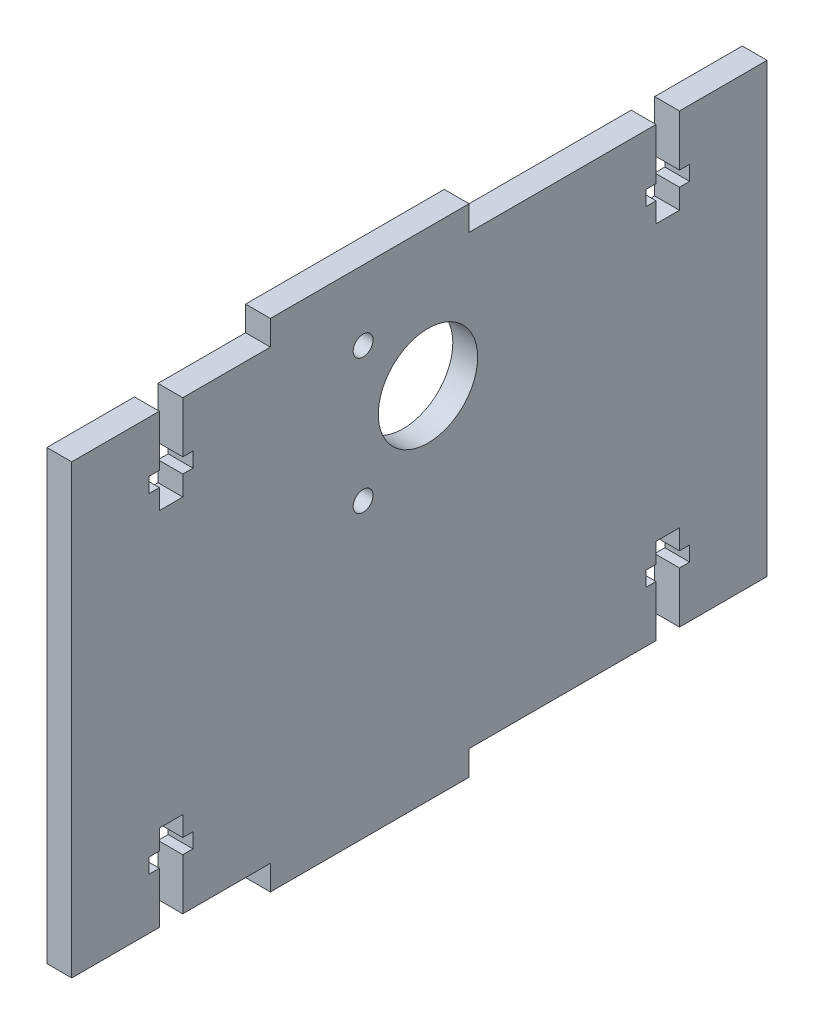
from build123d import *

# Parameters (mm, degrees)
SKETCH1_W           = 88.9
SKETCH1_H           = 63.5
BOSS_EXTRUDE1_DEPTH = 3.175
SKETCH2_W           = 38.1
SKETCH2_H           = 3.175
CUT_EXTRUDE1_DEPTH  = 55.716959208
CUT_EXTRUDE2_DEPTH  = 55.716959208
SKETCH4_R           = 6.35
SKETCH4_R_2         = 1.27
CUT_EXTRUDE3_DEPTH  = 55.716959208


with BuildPart() as part:
    # Sketch1 → Boss-Extrude1 (new body)
    with BuildSketch(Plane(origin=(0, 0, 0), x_dir=(0, 0, -1), z_dir=(1, 0, 0))):
        Rectangle(SKETCH1_W, SKETCH1_H)
    extrude(amount=BOSS_EXTRUDE1_DEPTH)

    # Sketch2 → Cut-Extrude1 (cut, through all)
    with BuildSketch(Plane(origin=(3.175, 0, 0), x_dir=(0, 0, -1), z_dir=(1, 0, 0))):
        with Locations((25.4, -30.1625)):
            Rectangle(SKETCH2_W, SKETCH2_H)
        Polygon((-19.05, 28.575), (-44.45, 28.575), (-44.45, 31.75), (-41.275, 31.75), (-19.05, 31.75), align=None)
        Polygon((-44.45, -31.75), (-41.275, -31.75), (-19.05, -31.75), (-19.05, -28.575), (-44.45, -28.575), align=None)
        with Locations((25.4, 30.1625)):
            Rectangle(SKETCH2_W, SKETCH2_H)
    extrude(amount=-CUT_EXTRUDE1_DEPTH, mode=Mode.SUBTRACT)

    # Sketch3 → Cut-Extrude2 (cut, through all)
    with BuildSketch(Plane(origin=(3.175, 0, 0), x_dir=(0, 0, -1), z_dir=(1, 0, 0))):
        Polygon((-30.25, -17.575), (-30.25, -20.125), (-28.95, -20.125), (-28.95, -22.025), (-30.25, -22.025), (-30.25, -28.575), (-33.25, -28.575), (-33.25, -22.025), (-34.55, -22.025), (-34.55, -20.125), (-33.25, -20.125), (-33.25, -17.575), align=None)
        Polygon((33.25, -17.575), (33.25, -20.125), (34.55, -20.125), (34.55, -22.025), (33.25, -22.025), (33.25, -28.575), (30.25, -28.575), (30.25, -22.025), (28.95, -22.025), (28.95, -20.125), (30.25, -20.125), (30.25, -17.575), align=None)
        Polygon((33.25, 20.125), (34.55, 20.125), (34.55, 22.025), (33.25, 22.025), (33.25, 28.575), (30.25, 28.575), (30.25, 22.025), (28.95, 22.025), (28.95, 20.125), (30.25, 20.125), (30.25, 17.575), (33.25, 17.575), align=None)
        Polygon((-30.25, 20.125), (-28.95, 20.125), (-28.95, 22.025), (-30.25, 22.025), (-30.25, 28.575), (-33.25, 28.575), (-33.25, 22.025), (-34.55, 22.025), (-34.55, 20.125), (-33.25, 20.125), (-33.25, 17.575), (-30.25, 17.575), align=None)
    extrude(amount=-CUT_EXTRUDE2_DEPTH, mode=Mode.SUBTRACT)

    # Sketch4 → Cut-Extrude3 (cut, through all)
    with BuildSketch(Plane(origin=(3.175, 0, 0), x_dir=(0, 0, -1), z_dir=(1, 0, 0))):
        with Locations((1.09372, 14.225)):
            Circle(SKETCH4_R)
        with Locations((-7.198382525, 5.625)):
            Circle(SKETCH4_R_2)
        with Locations((-7.198382525, 22.825)):
            Circle(SKETCH4_R_2)
    extrude(amount=-CUT_EXTRUDE3_DEPTH, mode=Mode.SUBTRACT)


solid = part.part
